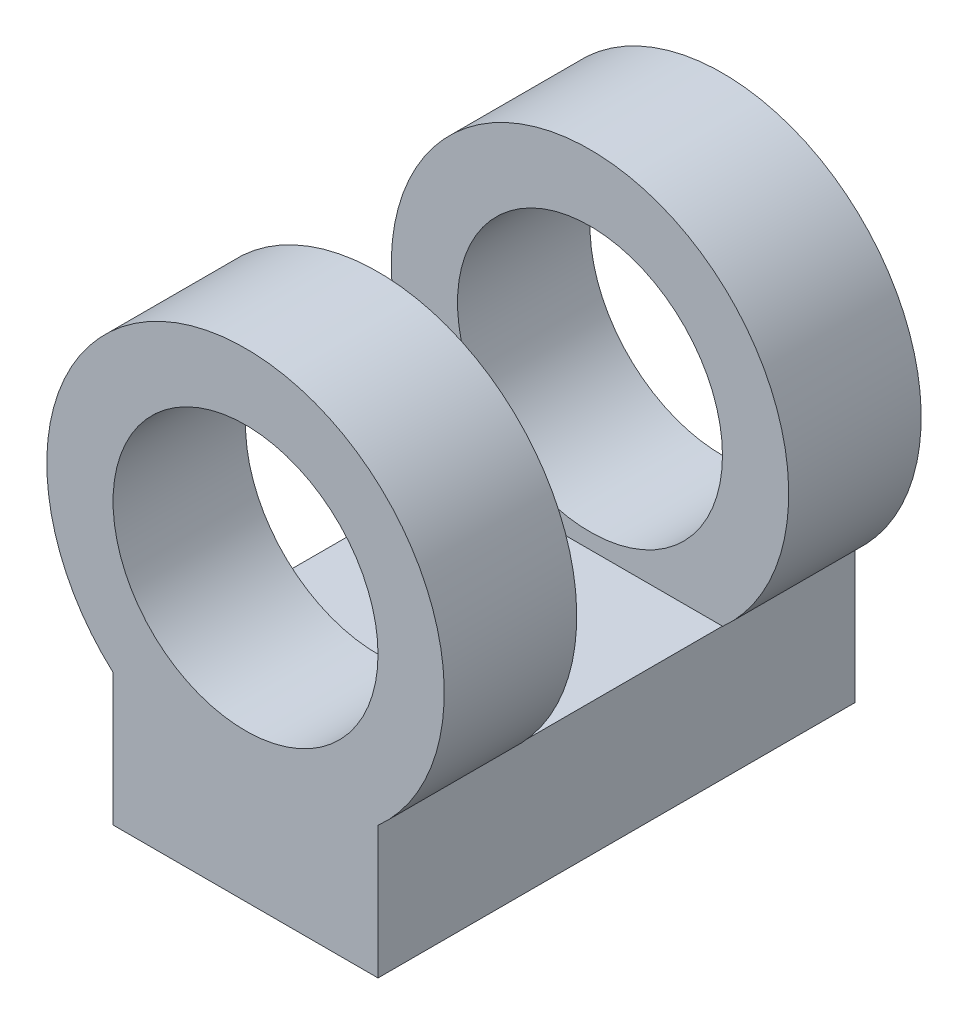
from build123d import *

# Parameters (mm, degrees)
SKETCH1_W           = 50
SKETCH1_H           = 90
BOSS_EXTRUDE1_DEPTH = 25
SKETCH2_R           = 37.5
BOSS_EXTRUDE2_DEPTH = 25
SKETCH3_R           = 25
CUT_EXTRUDE1_DEPTH  = 25
LPATTERN3_COUNT     = 2
LPATTERN3_PITCH     = 65


with BuildPart() as part:
    # Sketch1 → Boss-Extrude1 (new body)
    with BuildSketch(Plane(origin=(0, 0, 0), x_dir=(1, 0, 0), z_dir=(0, 1, 0))):
        Rectangle(SKETCH1_W, SKETCH1_H)
    extrude(amount=BOSS_EXTRUDE1_DEPTH)

    # Sketch2 → Boss-Extrude2 (add)
    with BuildSketch(Plane.XY.offset(45)):
        with Locations((0, 52.9)):
            Circle(SKETCH2_R)
    boss_extrude2 = extrude(amount=-BOSS_EXTRUDE2_DEPTH)

    # Sketch3 → Cut-Extrude1 (cut)
    with BuildSketch(Plane.XY.offset(45)):
        with Locations((0, 52.9)):
            Circle(SKETCH3_R)
    cut_extrude1 = extrude(amount=-CUT_EXTRUDE1_DEPTH, mode=Mode.SUBTRACT)

    # LPattern3: Boss-Extrude2, Cut-Extrude1 ×2
    with Locations(*[(0, 0, -i * LPATTERN3_PITCH) for i in range(1, LPATTERN3_COUNT)]):
        add(boss_extrude2)
        add(cut_extrude1, mode=Mode.SUBTRACT)


solid = part.part
